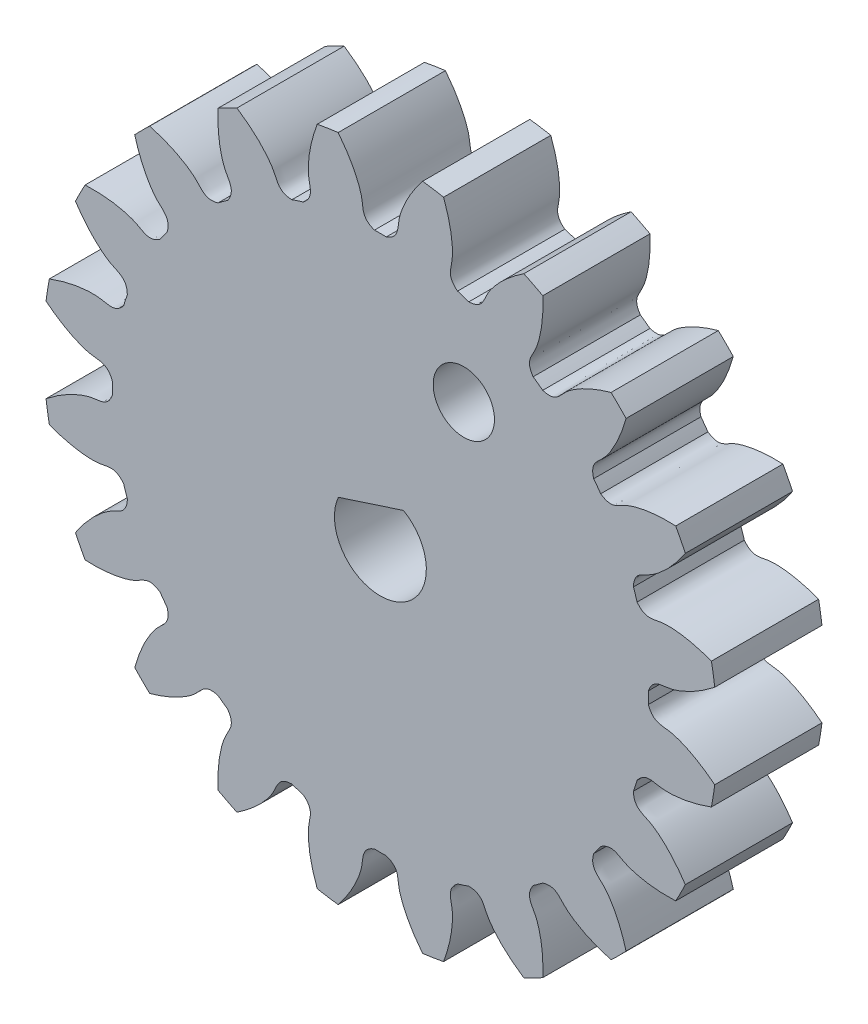
from build123d import *

# Parameters (mm, degrees)
SKETCH_1_R               = 22
EXTRUDE_1_DEPTH          = 7
CUT_EXTRUDE_1_DEPTH      = 32.890437438
PATTERN_CIRCULAR_1_COUNT = 20
SKETCH_4_R               = 2
CUT_EXTRUDE_2_DEPTH      = 10


with BuildPart() as part:
    # 草图1 → 凸台-拉伸1 (new body)
    with BuildSketch(Plane.XY):
        Circle(SKETCH_1_R)
    extrude(amount=EXTRUDE_1_DEPTH)

    # 草图2 → 切除-拉伸1 (cut, through all)
    with BuildSketch(Plane.XY):
        with BuildLine():
            ThreePointArc((0.386633201, 17.495728472), (0, 17.5), (-0.386633201, 17.495728472))
            add(Edge.make_bspline(
                [(-0.386633201, 17.495728472), (-1.22237881, 17.786951024), (-1.114168199, 18.374227398), (-1.225794113, 18.940018805), (-1.237784373, 18.995113228), (-1.25262178, 19.05726923), (-1.270584194, 19.126393672), (-1.29195828, 19.202382994), (-1.31702411, 19.285125656), (-1.346059743, 19.374501466), (-1.3793395, 19.470381894), (-1.4171342, 19.57263009), (-1.459710797, 19.681101001), (-1.507332204, 19.795641461), (-1.560257063, 19.916090303), (-1.618739529, 20.042278463), (-1.683029067, 20.174029102), (-1.753370234, 20.311157723), (-1.830002477, 20.4534723), (-1.913159931, 20.600773408), (-2.003071219, 20.752854362), (-2.099959252, 20.909501356), (-2.204041043, 21.070493611), (-2.315527511, 21.235603527), (-2.434623302, 21.404596841), (-2.561526601, 21.577232781), (-2.696428961, 21.753264241), (-2.839515123, 21.932437945), (-2.990962853, 22.114494623), (-3.15094277, 22.299169189), (-3.319618193, 22.486190926), (-3.497144978, 22.67528367), (-3.683671369, 22.866166005), (-3.879337852, 23.058551454), (-4.084277013, 23.252148679), (-4.298613397, 23.446661685), (-4.522463379, 23.641790022), (-4.755935037, 23.837228999), (-4.999128023, 24.032669892), (-5.252133469, 24.227800163), (-5.515033799, 24.42230368), (-5.882947182, 24.683279735), (-6.167864825, 24.872665202), (-6.362315964, 24.996503719)],
                knots=[0, 0, 0, 0, 0.165916003, 0.170905922, 0.176663519, 0.183188797, 0.190481754, 0.198542391, 0.207370708, 0.216966704, 0.22733038, 0.238461736, 0.250360771, 0.263027487, 0.276461881, 0.290663956, 0.30563371, 0.321371144, 0.337876258, 0.355149051, 0.373189524, 0.391997677, 0.411573509, 0.431917021, 0.453028213, 0.474907084, 0.497553636, 0.520967867, 0.545149777, 0.570099367, 0.595816637, 0.622301587, 0.649554216, 0.677574526, 0.706362514, 0.735918183, 0.766241531, 0.797332559, 0.829191267, 0.861817654, 0.895211721, 0.929373468, 1, 1, 1, 1], degree=3))
            ThreePointArc((-6.362315964, 24.996503719), (0, 25.793492641), (6.362315964, 24.996503719))
            add(Edge.make_bspline(
                [(0.386633201, 17.495728472), (1.22237881, 17.786951024), (1.114168199, 18.374227398), (1.225794113, 18.940018805), (1.237784373, 18.995113228), (1.25262178, 19.05726923), (1.270584194, 19.126393672), (1.29195828, 19.202382994), (1.31702411, 19.285125656), (1.346059743, 19.374501466), (1.3793395, 19.470381894), (1.4171342, 19.57263009), (1.459710797, 19.681101001), (1.507332204, 19.795641461), (1.560257063, 19.916090303), (1.618739529, 20.042278463), (1.683029067, 20.174029102), (1.753370234, 20.311157723), (1.830002477, 20.4534723), (1.913159931, 20.600773408), (2.003071219, 20.752854362), (2.099959252, 20.909501356), (2.204041043, 21.070493611), (2.315527511, 21.235603527), (2.434623302, 21.404596841), (2.561526601, 21.577232781), (2.696428961, 21.753264241), (2.839515123, 21.932437945), (2.990962853, 22.114494623), (3.15094277, 22.299169189), (3.319618193, 22.486190926), (3.497144978, 22.67528367), (3.683671369, 22.866166005), (3.879337852, 23.058551454), (4.084277013, 23.252148679), (4.298613397, 23.446661685), (4.522463379, 23.641790022), (4.755935037, 23.837228999), (4.999128023, 24.032669892), (5.252133469, 24.227800163), (5.515033799, 24.42230368), (5.882947182, 24.683279735), (6.167864825, 24.872665202), (6.362315964, 24.996503719)],
                knots=[0, 0, 0, 0, 0.165916003, 0.170905922, 0.176663519, 0.183188797, 0.190481754, 0.198542391, 0.207370708, 0.216966704, 0.22733038, 0.238461736, 0.250360771, 0.263027487, 0.276461881, 0.290663956, 0.30563371, 0.321371144, 0.337876258, 0.355149051, 0.373189524, 0.391997677, 0.411573509, 0.431917021, 0.453028213, 0.474907084, 0.497553636, 0.520967867, 0.545149777, 0.570099367, 0.595816637, 0.622301587, 0.649554216, 0.677574526, 0.706362514, 0.735918183, 0.766241531, 0.797332559, 0.829191267, 0.861817654, 0.895211721, 0.929373468, 1, 1, 1, 1], degree=3))
        make_face()
    cut_extrude_1 = extrude(amount=CUT_EXTRUDE_1_DEPTH, mode=Mode.SUBTRACT)

    # 阵列(圆周)1: 切除-拉伸1 ×20 about axis
    pattern_circular_1_axis = Axis((0, 0, -0.25), (0, 0, 1))
    for i in range(1, PATTERN_CIRCULAR_1_COUNT):
        add(cut_extrude_1.rotate(pattern_circular_1_axis, i * 360 / PATTERN_CIRCULAR_1_COUNT), mode=Mode.SUBTRACT)

    # 草图4 → 切除-拉伸2 (cut)
    with BuildSketch(Plane.XY.offset(7)):
        with Locations((5.447885997, 10.69207829)):
            Circle(SKETCH_4_R)
        with BuildLine():
            Line((1.508593032, 2.593096038), (-2.74466101, 1.211130027))
            ThreePointArc((-2.74466101, 1.211130027), (0.927050983, -2.853169549), (1.508593032, 2.593096038))
        make_face()
    extrude(amount=-CUT_EXTRUDE_2_DEPTH, mode=Mode.SUBTRACT)


solid = part.part
